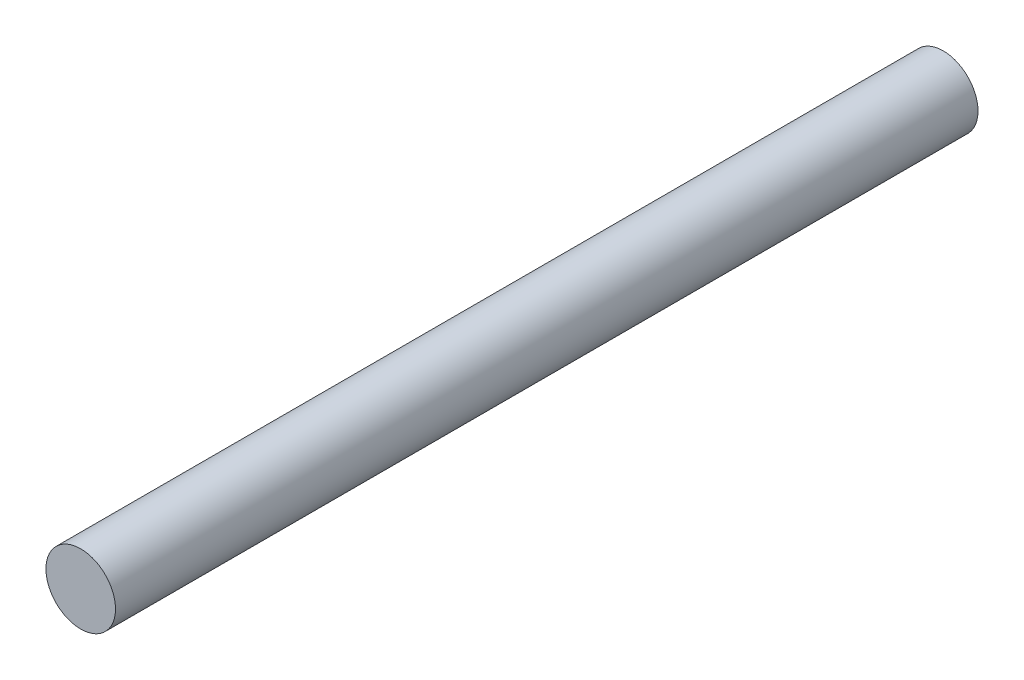
from build123d import *

# Parameters (mm, degrees)
SKETCH_1_R      = 2.5
EXTRUDE_1_DEPTH = 62


with BuildPart() as part:
    # Эскиз1 → Бобышка-Вытянуть1 (new body)
    with BuildSketch(Plane.XY):
        Circle(SKETCH_1_R)
    extrude(amount=EXTRUDE_1_DEPTH)


solid = part.part
